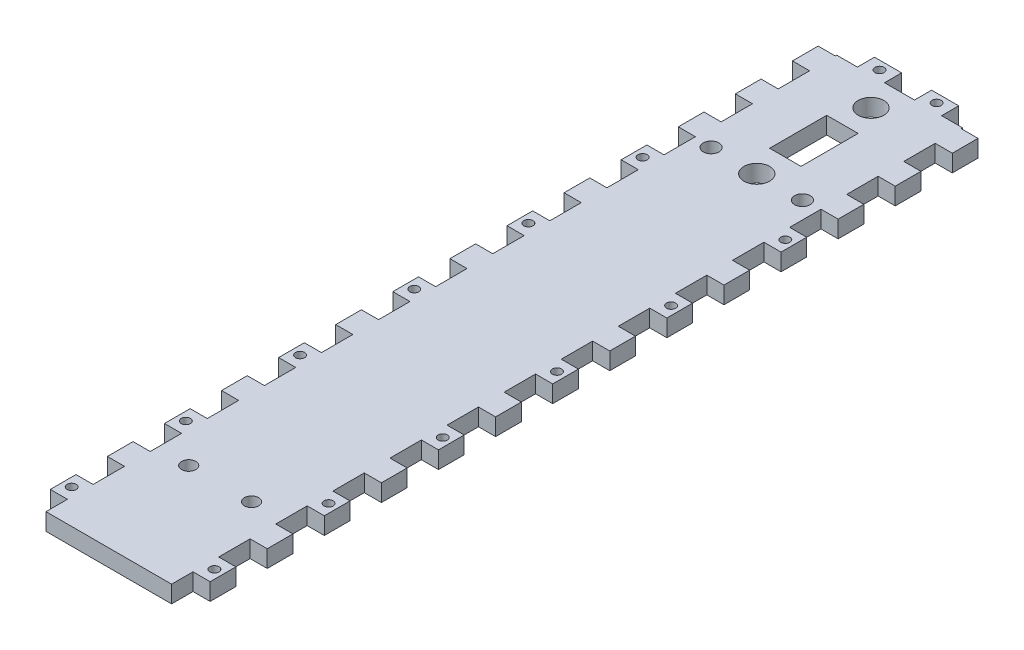
from build123d import *

# Parameters (mm, degrees)
SKETCH1_W               = 44
SKETCH1_H               = 277
SKETCH1_W_2             = 6
SKETCH1_H_2             = 9
SKETCH1_W_3             = 9.5
SKETCH1_H_3             = 6
BOSS_EXTRUDE1_DEPTH     = 6
CUT_EXTRUDE1_DEPTH      = 288.445647036
CUT_EXTRUDE1_DEPTH_BACK = 288.445647036
SKETCH2_R               = 4.5
SKETCH2_R_2             = 2.75
SKETCH2_W               = 11
SKETCH2_H               = 20
CUT_EXTRUDE3_DEPTH      = 288.445647036
CUT_EXTRUDE3_DEPTH_BACK = 288.445647036
SKETCH4_R               = 2.5
CUT_EXTRUDE4_DEPTH      = 288.445647036
CUT_EXTRUDE4_DEPTH_BACK = 288.445647036
SKETCH5_R               = 1.6


with BuildPart() as part:
    # Sketch1 → Boss-Extrude1 (new body)
    with BuildSketch(Plane(origin=(0, 0, 0), x_dir=(1, 0, 0), z_dir=(0, 1, 0))):
        with Locations((22, 138.5)):
            Rectangle(SKETCH1_W, SKETCH1_H)
        with Locations((-3, 12)):
            Rectangle(SKETCH1_W_2, SKETCH1_H_2)
        with Locations((-3, 32)):
            Rectangle(SKETCH1_W_2, SKETCH1_H_2)
        with Locations((-3, 52)):
            Rectangle(SKETCH1_W_2, SKETCH1_H_2)
        with Locations((-3, 72)):
            Rectangle(SKETCH1_W_2, SKETCH1_H_2)
        with Locations((-3, 92)):
            Rectangle(SKETCH1_W_2, SKETCH1_H_2)
        with Locations((-3, 112)):
            Rectangle(SKETCH1_W_2, SKETCH1_H_2)
        with Locations((-3, 132)):
            Rectangle(SKETCH1_W_2, SKETCH1_H_2)
        with Locations((-3, 152)):
            Rectangle(SKETCH1_W_2, SKETCH1_H_2)
        with Locations((-3, 172)):
            Rectangle(SKETCH1_W_2, SKETCH1_H_2)
        with Locations((-3, 192)):
            Rectangle(SKETCH1_W_2, SKETCH1_H_2)
        with Locations((-3, 212)):
            Rectangle(SKETCH1_W_2, SKETCH1_H_2)
        with Locations((-3, 232)):
            Rectangle(SKETCH1_W_2, SKETCH1_H_2)
        with Locations((-3, 252)):
            Rectangle(SKETCH1_W_2, SKETCH1_H_2)
        with Locations((-3, 272)):
            Rectangle(SKETCH1_W_2, SKETCH1_H_2)
        with Locations((12, 280)):
            Rectangle(SKETCH1_W_3, SKETCH1_H_3)
        with Locations((32, 280)):
            Rectangle(SKETCH1_W_3, SKETCH1_H_3)
        with Locations((47, 272)):
            Rectangle(SKETCH1_W_2, SKETCH1_H_2)
        with Locations((47, 252)):
            Rectangle(SKETCH1_W_2, SKETCH1_H_2)
        with Locations((47, 232)):
            Rectangle(SKETCH1_W_2, SKETCH1_H_2)
        with Locations((47, 212)):
            Rectangle(SKETCH1_W_2, SKETCH1_H_2)
        with Locations((47, 192)):
            Rectangle(SKETCH1_W_2, SKETCH1_H_2)
        with Locations((47, 172)):
            Rectangle(SKETCH1_W_2, SKETCH1_H_2)
        with Locations((47, 152)):
            Rectangle(SKETCH1_W_2, SKETCH1_H_2)
        with Locations((47, 132)):
            Rectangle(SKETCH1_W_2, SKETCH1_H_2)
        with Locations((47, 112)):
            Rectangle(SKETCH1_W_2, SKETCH1_H_2)
        with Locations((47, 92)):
            Rectangle(SKETCH1_W_2, SKETCH1_H_2)
        with Locations((47, 72)):
            Rectangle(SKETCH1_W_2, SKETCH1_H_2)
        with Locations((47, 52)):
            Rectangle(SKETCH1_W_2, SKETCH1_H_2)
        with Locations((47, 32)):
            Rectangle(SKETCH1_W_2, SKETCH1_H_2)
        with Locations((47, 12)):
            Rectangle(SKETCH1_W_2, SKETCH1_H_2)
    extrude(amount=BOSS_EXTRUDE1_DEPTH)

    # Sketch2 → Cut-Extrude1 (cut, two sides: drawn at the far end of the back side and taken through both)
    with BuildSketch(Plane(origin=(0, 6, 0), x_dir=(1, 0, 0), z_dir=(0, 1, 0)).offset(-CUT_EXTRUDE1_DEPTH_BACK)):
        with Locations(Location((22, 267, 0), (0, 0, 270))):
            Circle(SKETCH2_R)
        with Locations(Location((22, 227, 0), (0, 0, 270))):
            Circle(SKETCH2_R)
        with Locations(Location((6, 227, 0), (0, 0, 270))):
            Circle(SKETCH2_R_2)
        with Locations(Location((38, 227, 0), (0, 0, 270))):
            Circle(SKETCH2_R_2)
        with Locations((22, 247)):
            Rectangle(SKETCH2_W, SKETCH2_H)
    extrude(amount=CUT_EXTRUDE1_DEPTH + CUT_EXTRUDE1_DEPTH_BACK, mode=Mode.SUBTRACT)

    # Sketch4 → Cut-Extrude3 (cut, two sides: drawn at the far end of the back side and taken through both)
    with BuildSketch(Plane(origin=(0, 6, 0), x_dir=(1, 0, 0), z_dir=(0, 1, 0)).offset(-CUT_EXTRUDE3_DEPTH_BACK)):
        with Locations(Location((33, 39, 0), (0, 0, 270))):
            Circle(SKETCH4_R)
        with Locations(Location((11, 39, 0), (0, 0, 270))):
            Circle(SKETCH4_R)
    extrude(amount=CUT_EXTRUDE3_DEPTH + CUT_EXTRUDE3_DEPTH_BACK, mode=Mode.SUBTRACT)

    # Sketch5 → Cut-Extrude4 (cut, two sides: drawn at the far end of the back side and taken through both)
    with BuildSketch(Plane(origin=(0, 6, 0), x_dir=(1, 0, 0), z_dir=(0, 1, 0)).offset(-CUT_EXTRUDE4_DEPTH_BACK)):
        with Locations(Location((-3, 12, 0), (0, 0, 270))):
            Circle(SKETCH5_R)
        with Locations(Location((47, 12, 0), (0, 0, 270))):
            Circle(SKETCH5_R)
        with Locations(Location((47, 52, 0), (0, 0, 270))):
            Circle(SKETCH5_R)
        with Locations(Location((47, 92, 0), (0, 0, 270))):
            Circle(SKETCH5_R)
        with Locations(Location((47, 132, 0), (0, 0, 270))):
            Circle(SKETCH5_R)
        with Locations(Location((47, 172, 0), (0, 0, 270))):
            Circle(SKETCH5_R)
        with Locations(Location((47, 212, 0), (0, 0, 270))):
            Circle(SKETCH5_R)
        with Locations(Location((-3, 52, 0), (0, 0, 270))):
            Circle(SKETCH5_R)
        with Locations(Location((-3, 92, 0), (0, 0, 270))):
            Circle(SKETCH5_R)
        with Locations(Location((-3, 132, 0), (0, 0, 270))):
            Circle(SKETCH5_R)
        with Locations(Location((-3, 172, 0), (0, 0, 270))):
            Circle(SKETCH5_R)
        with Locations(Location((-3, 212, 0), (0, 0, 270))):
            Circle(SKETCH5_R)
        with Locations(Location((32, 280, 0), (0, 0, 270))):
            Circle(SKETCH5_R)
        with Locations(Location((12, 280, 0), (0, 0, 270))):
            Circle(SKETCH5_R)
    extrude(amount=CUT_EXTRUDE4_DEPTH + CUT_EXTRUDE4_DEPTH_BACK, mode=Mode.SUBTRACT)


solid = part.part
